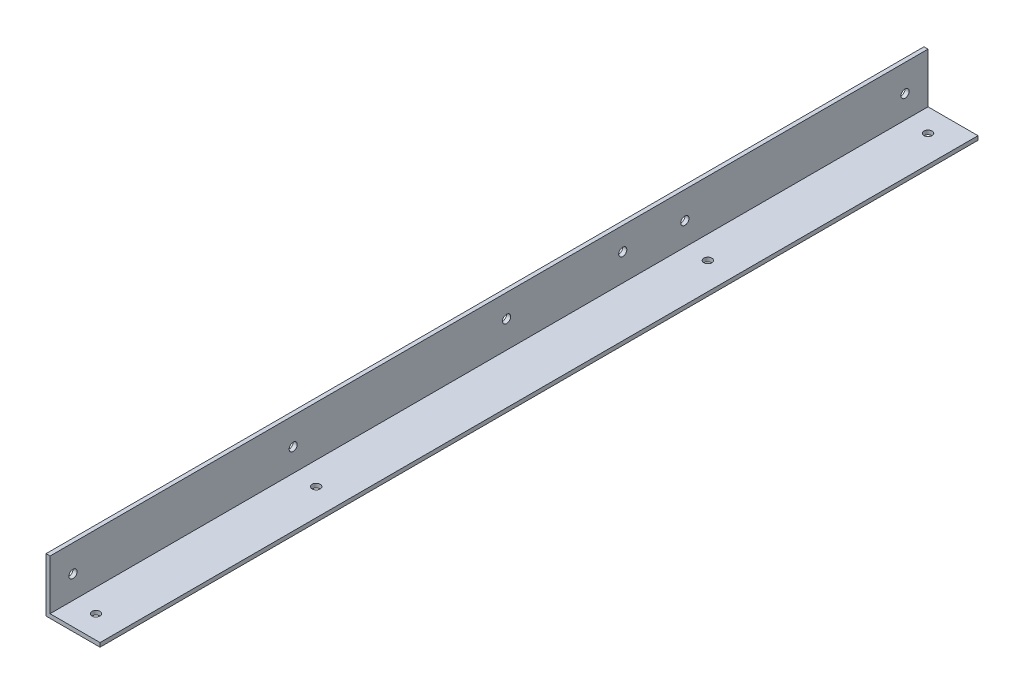
from build123d import *

# Parameters (mm, degrees)
EXTRUSION1_DEPTH = 325
ESQUISSE2_R      = 1.5
EXTRUSION2_DEPTH = 300
ESQUISSE3_R      = 1.5
EXTRUSION3_DEPTH = 300


with BuildPart() as part:
    # Esquisse1 → Extrusion1 (new body)
    with BuildSketch(Plane.XY):
        Polygon((-17.43168638, 4.773368421), (-17.43168638, -15.226631579), (2.56831362, -15.226631579), (2.56831362, -13.726631579), (-15.93168638, -13.726631579), (-15.93168638, 4.773368421), align=None)
    extrude(amount=EXTRUSION1_DEPTH)

    # Esquisse2 → Extrusion2 (cut)
    with BuildSketch(Plane(origin=(0, -13.726631579, 0), x_dir=(-1, 0, 0), z_dir=(0, 1, 0))):
        with Locations((7.43168638, 8.5)):
            Circle(ESQUISSE2_R)
        with Locations((7.43168638, 316.5)):
            Circle(ESQUISSE2_R)
        with Locations((7.43168638, 235)):
            Circle(ESQUISSE2_R)
        with Locations((7.43168638, 90)):
            Circle(ESQUISSE2_R)
    extrude(amount=-EXTRUSION2_DEPTH, mode=Mode.SUBTRACT)

    # Esquisse3 → Extrusion3 (cut)
    with BuildSketch(Plane(origin=(-15.93168638, 0, 0), x_dir=(0, 0, -1), z_dir=(1, 0, 0))):
        with Locations((-316.5, -5.226631579)):
            Circle(ESQUISSE3_R)
        with Locations((-8.5, -5.226631579)):
            Circle(ESQUISSE3_R)
        with Locations((-235, -5.226631579)):
            Circle(ESQUISSE3_R)
        with Locations((-90, -5.226631579)):
            Circle(ESQUISSE3_R)
        with Locations((-113, -3.726631579)):
            Circle(ESQUISSE3_R)
        with Locations((-156, -3.726631579)):
            Circle(ESQUISSE3_R)
    extrude(amount=-EXTRUSION3_DEPTH, mode=Mode.SUBTRACT)


solid = part.part
